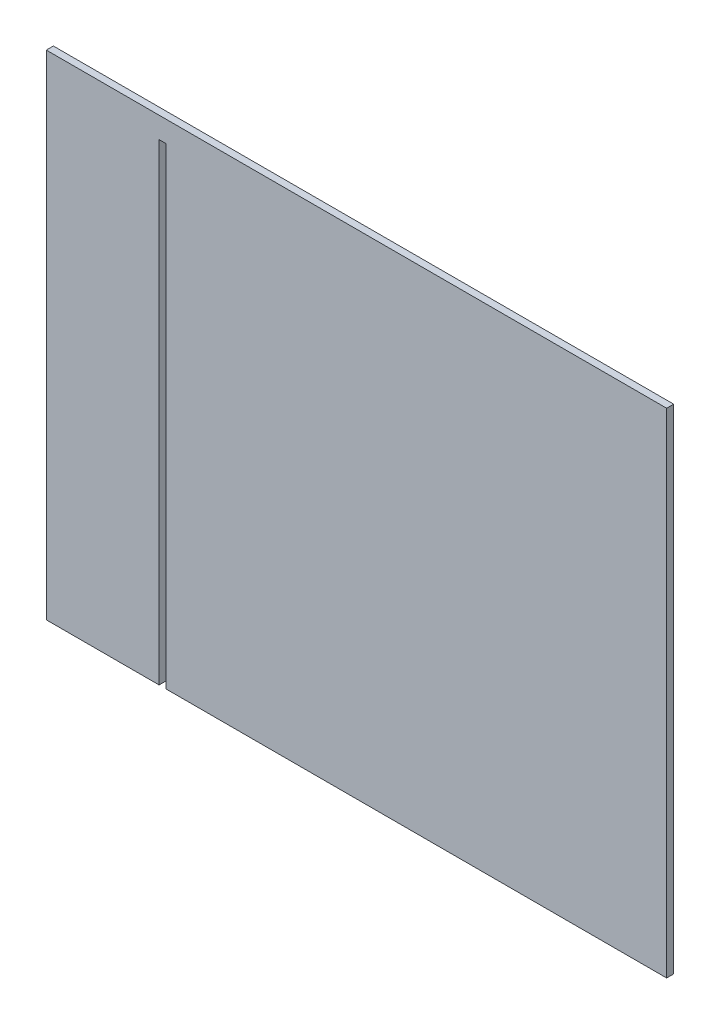
from build123d import *

# Parameters (mm, degrees)
CROQUIS1_W              = 440
CROQUIS1_H              = 350
SALIENTE_EXTRUIR1_DEPTH = 5
CROQUIS2_W              = 5
CROQUIS2_H              = 335
CORTAR_EXTRUIR1_DEPTH   = 5


with BuildPart() as part:
    # Croquis1 → Saliente-Extruir1 (new body)
    with BuildSketch(Plane.XY):
        with Locations((54.331395349, -59.985465116)):
            Rectangle(CROQUIS1_W, CROQUIS1_H)
    extrude(amount=SALIENTE_EXTRUIR1_DEPTH)

    # Croquis2 → Cortar-Extruir1 (cut)
    with BuildSketch(Plane.XY.offset(5)):
        with Locations((-83.168604651, -67.485465116)):
            Rectangle(CROQUIS2_W, CROQUIS2_H)
    extrude(amount=-CORTAR_EXTRUIR1_DEPTH, mode=Mode.SUBTRACT)


solid = part.part
